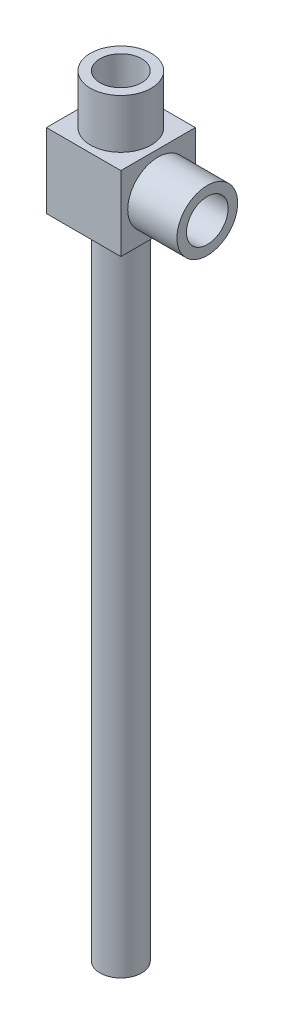
from build123d import *

# Parameters (mm, degrees)
CROQUIS2_R              = 12.7
SALIENTE_EXTRUIR1_DEPTH = 394.55
CROQUIS4_W              = 45.4
CROQUIS4_H              = 45.4
SALIENTE_EXTRUIR2_DEPTH = 45.4
CROQUIS5_R              = 18.5
CROQUIS5_R_2            = 12.7
SALIENTE_EXTRUIR3_DEPTH = 30
SALIENTE_EXTRUIR4_START = 75.4
CROQUIS7_R              = 18.5
CROQUIS7_R_2            = 12.7
SALIENTE_EXTRUIR4_DEPTH = 75.4


with BuildPart() as part:
    # Croquis2 → Saliente-Extruir1 (new body)
    with BuildSketch(Plane(origin=(0, -12.7, 0), x_dir=(1, 0, 0), z_dir=(0, 1, 0))):
        with Locations(Location((0, -37.25, 0), (0, 0, 270))):
            Circle(CROQUIS2_R)
    extrude(amount=-SALIENTE_EXTRUIR1_DEPTH)

    # Croquis4 → Saliente-Extruir2 (add)
    with BuildSketch(Plane(origin=(0, -12.7, 0), x_dir=(1, 0, 0), z_dir=(0, 1, 0))):
        with Locations((0, -37.25)):
            Rectangle(CROQUIS4_W, CROQUIS4_H)
    extrude(amount=SALIENTE_EXTRUIR2_DEPTH)

    # Croquis5 → Saliente-Extruir3 (add)
    with BuildSketch(Plane(origin=(22.7, 0, 0), x_dir=(0, 0, -1), z_dir=(1, 0, 0))):
        with Locations(Location((-37.25, 10, 0), (0, 0, 180))):
            Circle(CROQUIS5_R)
        with Locations((-37.25, 10)):
            Circle(CROQUIS5_R_2, mode=Mode.SUBTRACT)
    extrude(amount=SALIENTE_EXTRUIR3_DEPTH)

    # Croquis7 → Saliente-Extruir4 (add)
    with BuildSketch(Plane(origin=(0, -12.7, 0), x_dir=(1, 0, 0), z_dir=(0, 1, 0)).offset(SALIENTE_EXTRUIR4_START)):
        with Locations(Location((0, -37.25, 0), (0, 0, 90))):
            Circle(CROQUIS7_R)
        with Locations(Location((0, -37.25, 0), (0, 0, 270))):
            Circle(CROQUIS7_R_2, mode=Mode.SUBTRACT)
    extrude(amount=-SALIENTE_EXTRUIR4_DEPTH)


solid = part.part
